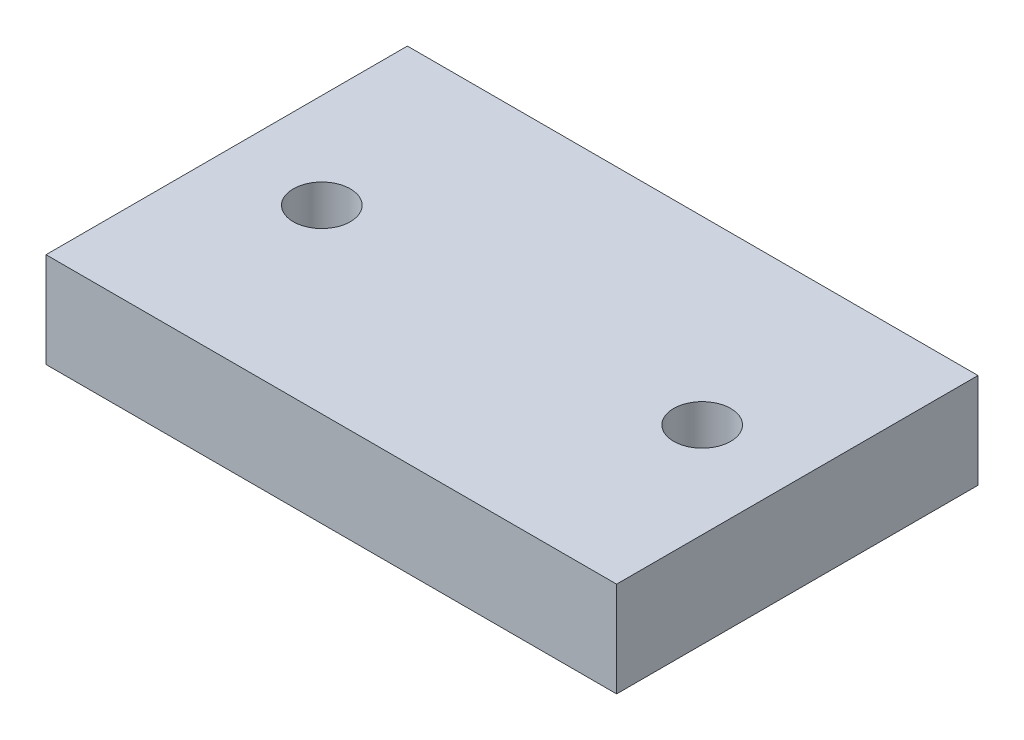
from build123d import *

# Parameters (mm, degrees)
SKETCH1_W           = 30
SKETCH1_H           = 19
SKETCH1_R           = 1.5
BOSS_EXTRUDE1_DEPTH = 2.5


with BuildPart() as part:
    # Sketch1 → Boss-Extrude1 (new, symmetric)
    with BuildSketch(Plane(origin=(0, 0, 0), x_dir=(1, 0, 0), z_dir=(0, 1, 0))):
        with Locations((15, 9.5)):
            Rectangle(SKETCH1_W, SKETCH1_H)
        with Locations(Location((5, 9.5, 0), (0, 0, 270))):
            Circle(SKETCH1_R, mode=Mode.SUBTRACT)
        with Locations(Location((25, 9.5, 0), (0, 0, 90))):
            Circle(SKETCH1_R, mode=Mode.SUBTRACT)
    extrude(amount=BOSS_EXTRUDE1_DEPTH, both=True)


solid = part.part
